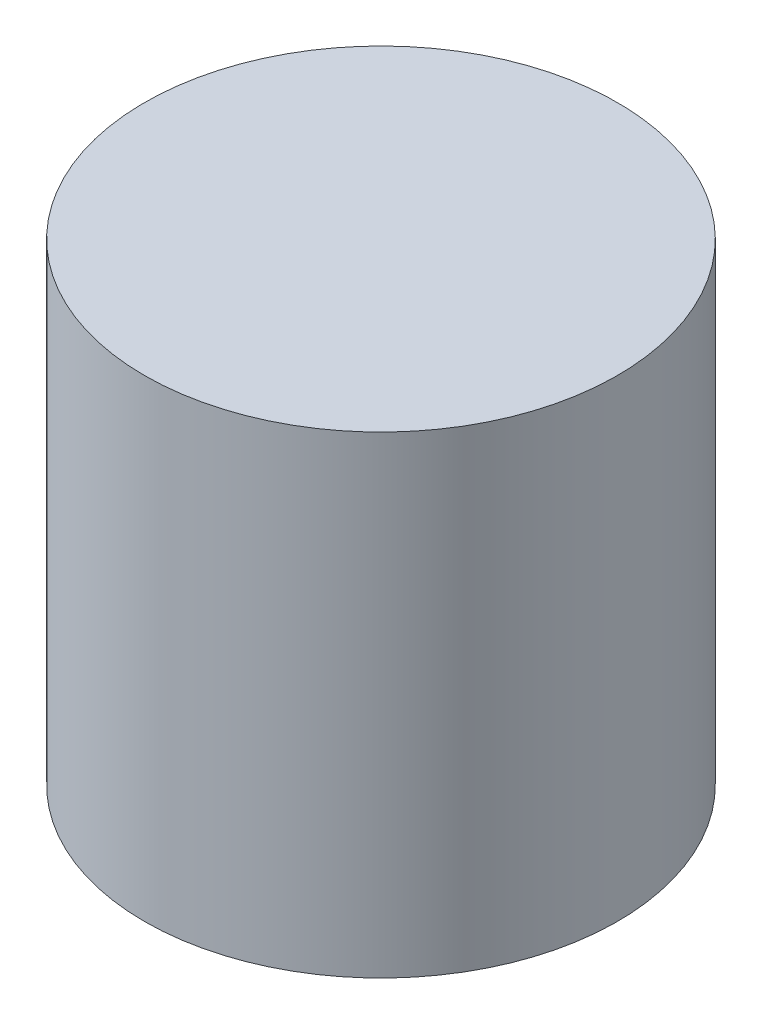
from build123d import *

# Parameters (mm, degrees)
CROQUIS1_R              = 3
SALIENTE_EXTRUIR1_DEPTH = 6


with BuildPart() as part:
    # Croquis1 → Saliente-Extruir1 (new body)
    with BuildSketch(Plane(origin=(0, 0, 0), x_dir=(1, 0, 0), z_dir=(0, 1, 0))):
        with Locations(Location((0, 0, 0), (0, 0, 270))):
            Circle(CROQUIS1_R)
    extrude(amount=SALIENTE_EXTRUIR1_DEPTH)


solid = part.part
